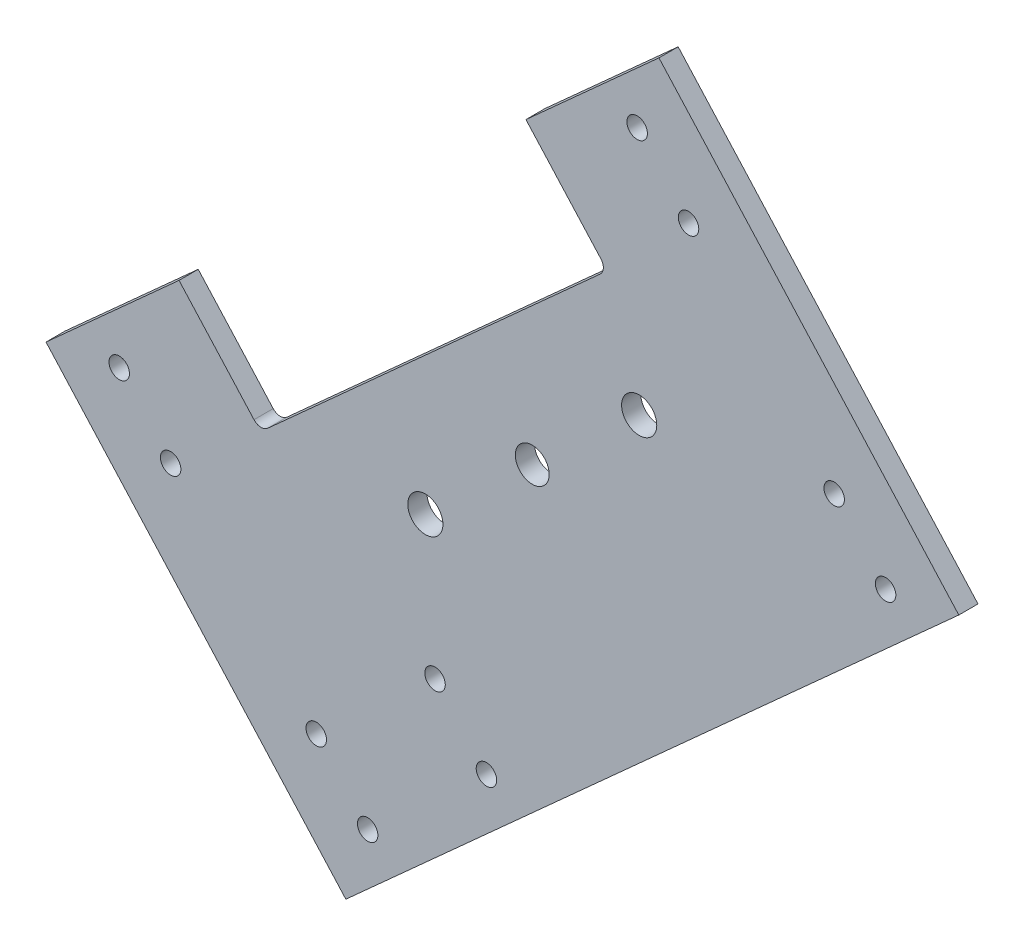
from build123d import *

# Parameters (mm, degrees)
EXTRUDE1_DEPTH     = 3
SKETCH2_R          = 2.65
CUT_EXTRUDE1_DEPTH = 5
SKETCH4_R          = 1.6
CUT_EXTRUDE3_DEPTH = 3


with BuildPart() as part:
    # Sketch1 → Extrude1 (new body)
    with BuildSketch(Plane.XY):
        Polygon((155.305831868, -303.657635717), (202.177156078, -355.648778874), (106.360004666, -442.030352657), (59.488680456, -390.0392095), align=None)
    extrude(amount=EXTRUDE1_DEPTH)

    # Sketch2 → Cut-Extrude1 (cut)
    with BuildSketch(Plane.XY.offset(3)):
        with Locations((135.499717478, -368.636757231)):
            Circle(SKETCH2_R)
    extrude(amount=-CUT_EXTRUDE1_DEPTH, mode=Mode.SUBTRACT)

    # Sketch4 → Cut-Extrude3 (cut)
    with BuildSketch(Plane.XY.offset(3)):
        with Locations((151.896067778, -314.809922875)):
            Circle(SKETCH4_R)
        with Locations((159.931151928, -323.722690273)):
            Circle(SKETCH4_R)
        with Locations((182.697223687, -348.975531235)):
            Circle(SKETCH4_R)
        with Locations((190.732307837, -357.888298634)):
            Circle(SKETCH4_R)
        with Locations((70.933528696, -387.79968974)):
            Circle(SKETCH4_R)
        with Locations((78.968612847, -396.712457139)):
            Circle(SKETCH4_R)
        with Locations((120.302950019, -405.225539455)):
            Circle(SKETCH4_R)
        with Locations((128.338034169, -414.138306853)):
            Circle(SKETCH4_R)
        with Locations((101.734684606, -421.965298101)):
            Circle(SKETCH4_R)
        with Locations((109.769768756, -430.878065499)):
            Circle(SKETCH4_R)
        with BuildLine():
            Line((80.285137719, -371.290679816), (134.509374605, -322.406165401))
            Line((134.509374605, -322.406165401), (146.227205658, -335.40395119))
            ThreePointArc((146.227205658, -335.40395119), (146.611102327, -336.485913681), (146.117495252, -337.522432634))
            Line((146.117495252, -337.522432634), (94.121450215, -384.398176011))
            ThreePointArc((94.121450215, -384.398176011), (93.039487724, -384.782072681), (92.002968771, -384.288465605))
            Line((92.002968771, -384.288465605), (80.285137719, -371.290679816))
        make_face()
        with BuildLine():
            ThreePointArc((154.253665546, -351.729600998), (150.369782899, -351.528465254), (150.168647155, -355.412347901))
            ThreePointArc((150.168647155, -355.412347901), (154.052529802, -355.613483645), (154.253665546, -351.729600998))
        make_face()
        with BuildLine():
            ThreePointArc((120.830787802, -381.861166562), (116.946905155, -381.660030818), (116.745769411, -385.543913464))
            ThreePointArc((116.745769411, -385.543913464), (120.629652058, -385.745049208), (120.830787802, -381.861166562))
        make_face()
    extrude(amount=-CUT_EXTRUDE3_DEPTH, mode=Mode.SUBTRACT)


solid = part.part
